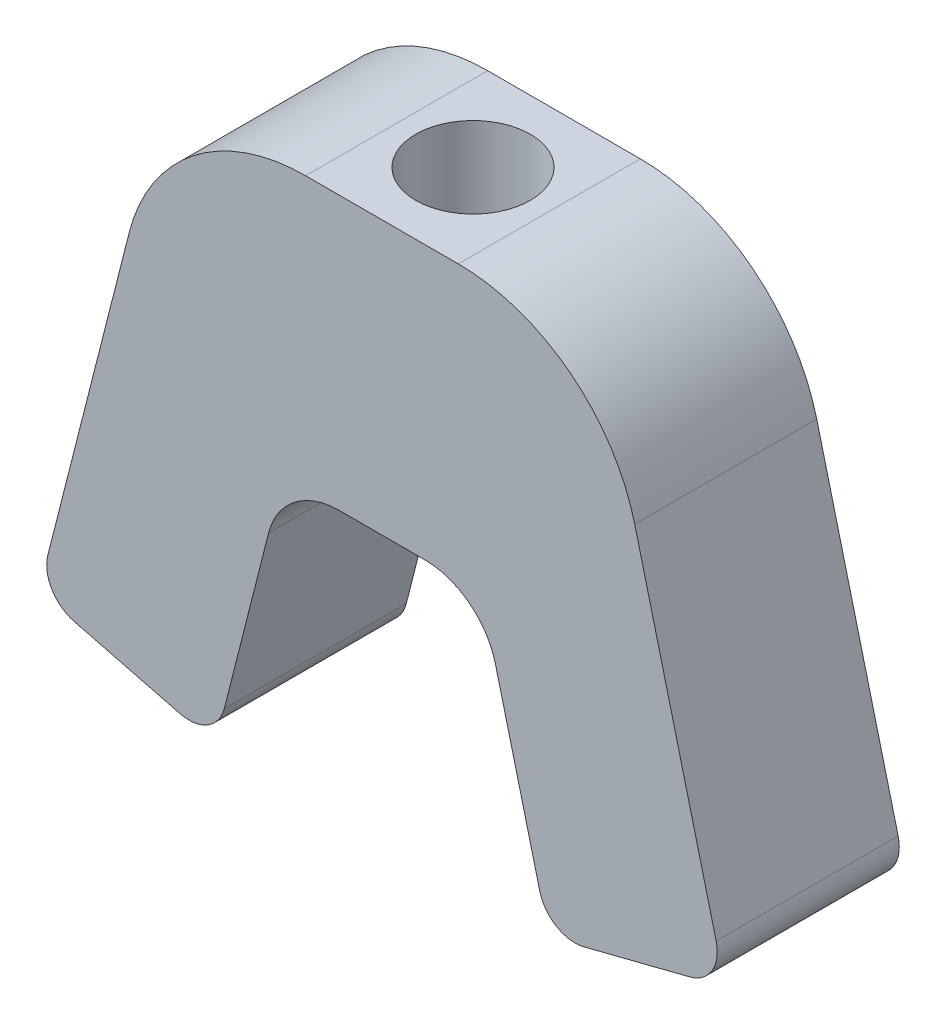
from build123d import *

# Parameters (mm, degrees)
BOSS_EXTRUDE1_DEPTH                 = 6.35
FILLET1_R                           = 6.35
FILLET2_R                           = 2.54
FILLET3_R                           = 1.27
F_8_32_TAPPED_HOLE3_D               = 4
F_8_32_TAPPED_HOLE3_DEPTH           = 10.70864
F_8_32_TAPPED_HOLE3_TIP             = 1.201721238
F_8_32_TAPPED_HOLE3_ON_FACE_2_D     = 4
F_8_32_TAPPED_HOLE3_ON_FACE_2_DEPTH = 10.70864
F_8_32_TAPPED_HOLE3_ON_FACE_2_TIP   = 1.201721238
F_8_32_TAPPED_HOLE3_ON_FACE_3_D     = 4
F_8_32_TAPPED_HOLE3_ON_FACE_3_DEPTH = 10.70864
F_8_32_TAPPED_HOLE3_ON_FACE_3_TIP   = 1.201721238


with BuildPart() as part:
    # Sketch1 → Boss-Extrude1 (new body)
    with BuildSketch(Plane.XY):
        Polygon((-11.971057013, -34.21026192), (-5.816733064, -35.774485923), (-3.470397058, -26.543), (3.470397058, -26.543), (5.816733064, -35.774485923), (11.971057013, -34.21026192), (7.601357108, -17.018), (-7.601357108, -17.018), align=None)
    extrude(amount=BOSS_EXTRUDE1_DEPTH)

    # Fillet1
    fillet1_edges = [part.edges().sort_by_distance(p)[0] for p in [
        (-7.601357108, -17.018, 3.175),
        (7.601357108, -17.018, 3.175),
    ]]
    fillet(fillet1_edges, radius=FILLET1_R)

    # Fillet2
    fillet2_edges = [part.edges().sort_by_distance(p)[0] for p in [
        (3.470397058, -26.543, 3.175),
        (-3.470397058, -26.543, 3.175),
    ]]
    fillet(fillet2_edges, radius=FILLET2_R)

    # Fillet3
    fillet3_edges = [part.edges().sort_by_distance(p)[0] for p in [
        (-5.816733064, -35.774485923, 3.175),
        (-11.971057013, -34.21026192, 3.175),
        (11.971057013, -34.21026192, 3.175),
        (5.816733064, -35.774485923, 3.175),
    ]]
    fillet(fillet3_edges, radius=FILLET3_R)

    # #8-32 Tapped Hole3
    with Locations(Plane(origin=(-8.893895038, -34.992373921, 3.175), x_dir=(-0.969184873822, 0.246334488763, 0), z_dir=(-0.246334488763, -0.969184873822, 0))):
        with Locations((0, 0)):
            Hole(F_8_32_TAPPED_HOLE3_D / 2, depth=F_8_32_TAPPED_HOLE3_DEPTH)
            with Locations((0, 0, -(F_8_32_TAPPED_HOLE3_DEPTH + F_8_32_TAPPED_HOLE3_TIP / 2))):  # 118° drill point
                Cone(0, F_8_32_TAPPED_HOLE3_D / 2, F_8_32_TAPPED_HOLE3_TIP, mode=Mode.SUBTRACT)

    # #8-32 Tapped Hole3 on face 2
    with Locations(Plane(origin=(8.893895038, -34.992373921, 3.175), x_dir=(-0.969184998168, -0.246333999534, 0), z_dir=(0.246333999534, -0.969184998168, 0))):
        with Locations((0, 0)):
            Hole(F_8_32_TAPPED_HOLE3_ON_FACE_2_D / 2, depth=F_8_32_TAPPED_HOLE3_ON_FACE_2_DEPTH)
            with Locations((0, 0, -(F_8_32_TAPPED_HOLE3_ON_FACE_2_DEPTH + F_8_32_TAPPED_HOLE3_ON_FACE_2_TIP / 2))):  # 118° drill point
                Cone(0, F_8_32_TAPPED_HOLE3_ON_FACE_2_D / 2, F_8_32_TAPPED_HOLE3_ON_FACE_2_TIP, mode=Mode.SUBTRACT)

    # #8-32 Tapped Hole3 on face 3
    with Locations(Plane(origin=(0, -17.018, 3.175), x_dir=(0, 0, 1), z_dir=(0, 1, 0))):
        with Locations((0, 0)):
            Hole(F_8_32_TAPPED_HOLE3_ON_FACE_3_D / 2, depth=F_8_32_TAPPED_HOLE3_ON_FACE_3_DEPTH)
            with Locations((0, 0, -(F_8_32_TAPPED_HOLE3_ON_FACE_3_DEPTH + F_8_32_TAPPED_HOLE3_ON_FACE_3_TIP / 2))):  # 118° drill point
                Cone(0, F_8_32_TAPPED_HOLE3_ON_FACE_3_D / 2, F_8_32_TAPPED_HOLE3_ON_FACE_3_TIP, mode=Mode.SUBTRACT)


solid = part.part
